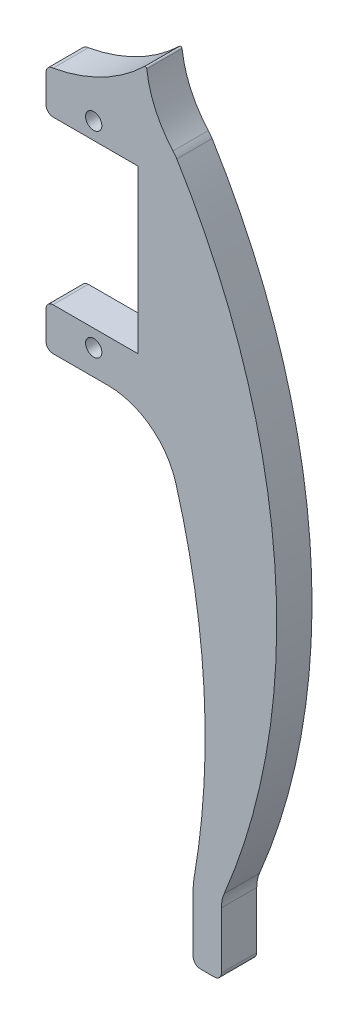
from build123d import *

# Parameters (mm, degrees)
BOSS_EXTRUDE1_DEPTH = 5
SKETCH2_R           = 1.15
CUT_EXTRUDE1_DEPTH  = 87.690729745
FILLET1_R           = 5
FILLET3_R           = 1
FILLET12_R          = 5
FILLET14_R          = 1
FILLET15_R          = 10
FILLET16_R          = 10
BOSS_EXTRUDE2_DEPTH = 5
FILLET17_R          = 0.2
FILLET18_R          = 15


with BuildPart() as part:
    # Sketch1 → Boss-Extrude1 (new body)
    with BuildSketch(Plane.XY):
        with BuildLine():
            Line((-6.5, 17.5), (-6.5, 11.5))
            Line((-6.5, 11.5), (6.5, 11.5))
            Line((6.5, 11.5), (6.5, -11.5))
            Line((6.5, -11.5), (-6.5, -11.5))
            Line((-6.5, -11.5), (-6.5, -17.5))
            Line((-6.5, -17.5), (9.5, -17.5))
            ThreePointArc((9.5, -17.5), (15.62941886, -44.673850811), (14.328125353, -72.5))
            Line((14.328125353, -72.5), (14.328125353, -82.5))
            Line((14.328125353, -82.5), (18.328125353, -82.5))
            Line((18.328125353, -82.5), (18.328125353, -72.5))
            ThreePointArc((18.328125353, -72.5), (25.796688212, -26.509948672), (10.5, 17.5))
            Line((10.5, 17.5), (-6.5, 17.5))
        make_face()
    extrude(amount=BOSS_EXTRUDE1_DEPTH)

    # Sketch2 → Cut-Extrude1 (cut, through all)
    with BuildSketch(Plane.XY.offset(5)):
        with Locations((0.25, 13.9)):
            Circle(SKETCH2_R)
        with Locations((0.25, -13.9)):
            Circle(SKETCH2_R)
    extrude(amount=-CUT_EXTRUDE1_DEPTH, mode=Mode.SUBTRACT)

    # Fillet1
    fillet1_edges = [part.edges().sort_by_distance(p)[0] for p in [
        (10.5, 17.5, 2.5),
    ]]
    fillet(fillet1_edges, radius=FILLET1_R)

    # Fillet3
    fillet3_edges = [part.edges().sort_by_distance(p)[0] for p in [
        (-6.5, -17.5, 2.5),
        (-6.5, -11.5, 2.5),
        (-6.5, 11.5, 2.5),
        (-6.5, 17.5, 2.5),
    ]]
    fillet(fillet3_edges, radius=FILLET3_R)

    # Fillet12
    fillet12_edges = [part.edges().sort_by_distance(p)[0] for p in [
        (18.328125353, -72.5, 2.5),
    ]]
    fillet(fillet12_edges, radius=FILLET12_R)

    # Fillet14
    fillet14_edges = [part.edges().sort_by_distance(p)[0] for p in [
        (18.328125353, -82.5, 2.5),
        (14.328125353, -82.5, 2.5),
    ]]
    fillet(fillet14_edges, radius=FILLET14_R)

    # Fillet15
    fillet15_edges = [part.edges().sort_by_distance(p)[0] for p in [
        (14.328125353, -72.5, 2.5),
    ]]
    fillet(fillet15_edges, radius=FILLET15_R)

    # Fillet16
    fillet16_edges = [part.edges().sort_by_distance(p)[0] for p in [
        (9.5, -17.5, 2.5),
    ]]
    fillet(fillet16_edges, radius=FILLET16_R)

    # Sketch3 → Boss-Extrude2 (add)
    with BuildSketch(Plane.XY.offset(5)):
        with BuildLine():
            Line((-5.5, 17.5), (7.758219973, 17.5))
            Line((7.758219973, 17.5), (7.758219973, 24.5))
            ThreePointArc((7.758219973, 24.5), (1.666211007, 19.982713789), (-5.5, 17.5))
        make_face()
    extrude(amount=-BOSS_EXTRUDE2_DEPTH)

    # Fillet17
    fillet17_edges = [part.edges().sort_by_distance(p)[0] for p in [
        (7.758219973, 24.5, 2.5),
    ]]
    fillet(fillet17_edges, radius=FILLET17_R)

    # Fillet18
    fillet18_edges = [part.edges().sort_by_distance(p)[0] for p in [
        (7.758219973, 17.5, 2.5),
    ]]
    fillet(fillet18_edges, radius=FILLET18_R)


solid = part.part
